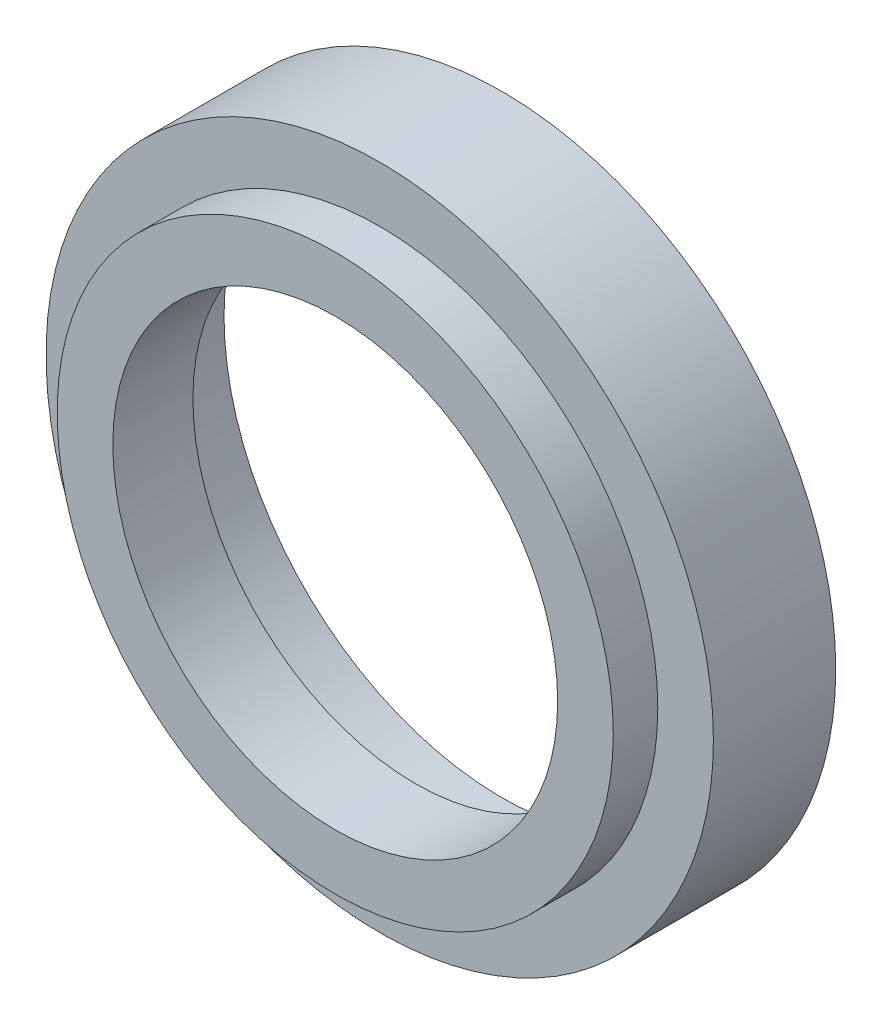
from build123d import *

# Parameters (mm, degrees)
ESQUISSE1_R             = 15
BOSS_EXTRU_1_DEPTH      = 7.5
ESQUISSE3_R             = 12.5
ENL_V_MAT_EXTRU_1_DEPTH = 3.9
ENL_V_START             = -2
ESQUISSE4_R             = 15.5
ESQUISSE4_R_2           = 12.5
ENL_V_MAT_EXTRU_2_DEPTH = 2
ESQUISSE5_R             = 10
ENL_V_MAT_EXTRU_4_DEPTH = 5


with BuildPart() as part:
    # Esquisse1 → Boss.-Extru.1 (new body)
    with BuildSketch(Plane.XY):
        Circle(ESQUISSE1_R)
    extrude(amount=BOSS_EXTRU_1_DEPTH)

    # Esquisse3 → Enlèv. mat.-Extru.1 (cut)
    with BuildSketch(Plane(origin=(0, 0, 0), x_dir=(-1, 0, 0), z_dir=(0, 0, -1))):
        Circle(ESQUISSE3_R)
    extrude(amount=-ENL_V_MAT_EXTRU_1_DEPTH, mode=Mode.SUBTRACT)

    # Esquisse4 → Enlèv. mat.-Extru.2 (cut)
    with BuildSketch(Plane.XY.offset(7.5).offset(ENL_V_START)):
        Circle(ESQUISSE4_R)
        with Locations(Location((0, 0, 0), (0, 0, 180))):
            Circle(ESQUISSE4_R_2, mode=Mode.SUBTRACT)
    extrude(amount=ENL_V_MAT_EXTRU_2_DEPTH, mode=Mode.SUBTRACT)

    # Esquisse5 → Enlèv. mat.-Extru.4 (cut)
    with BuildSketch(Plane.XY.offset(7.5)):
        Circle(ESQUISSE5_R)
    extrude(amount=-ENL_V_MAT_EXTRU_4_DEPTH, mode=Mode.SUBTRACT)


solid = part.part
